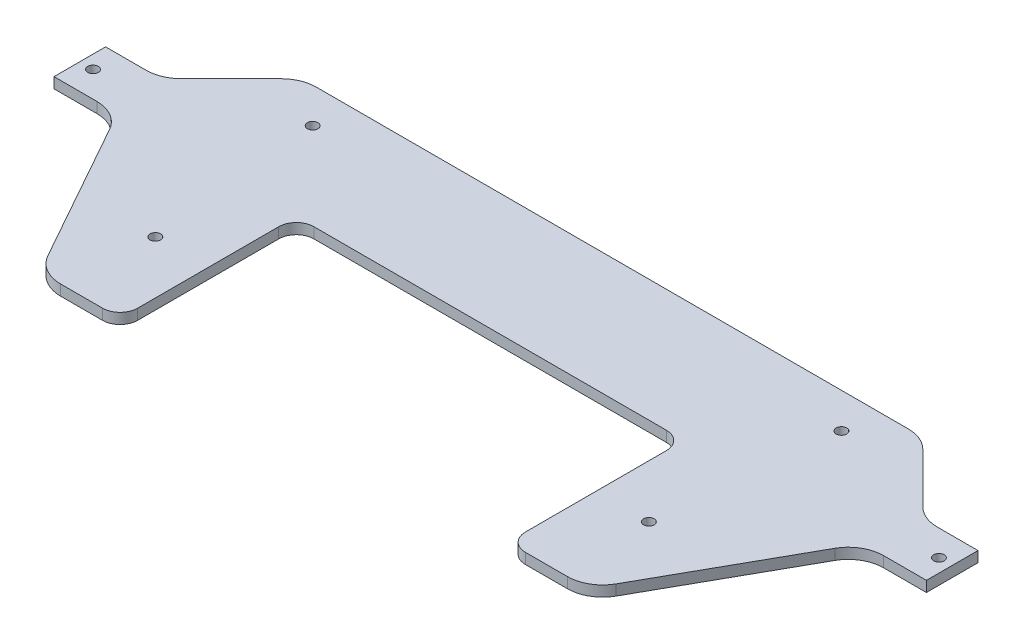
from build123d import *

# Parameters (mm, degrees)
SALIENTE_EXTRUIR1_DEPTH = 3
REDONDEO1_R             = 10
CROQUIS2_R              = 1.5
CORTAR_EXTRUIR1_DEPTH   = 135.610141171
CROQUIS4_W              = 110
CROQUIS4_H              = 50
CORTAR_EXTRUIR2_DEPTH   = 135.610141171
REDONDEO2_R             = 5
CROQUIS5_W              = 4
CROQUIS5_H              = 14.636342218
CORTAR_EXTRUIR3_DEPTH   = 135.610141171


with BuildPart() as part:
    # Croquis1 → Saliente-Extruir1 (new body)
    with BuildSketch(Plane(origin=(0, 0, 0), x_dir=(1, 0, 0), z_dir=(0, 1, 0))):
        Polygon((-88.1, 42.318171109), (88.1, 42.318171109), (108.1, 22.318171109), (127.75, 22.318171109), (127.75, 7.681828891), (105.75, 7.681828891), (77.75, -42.318171109), (-77.75, -42.318171109), (-105.75, 7.681828891), (-127.75, 7.681828891), (-127.75, 22.318171109), (-108.1, 22.318171109), align=None)
    extrude(amount=SALIENTE_EXTRUIR1_DEPTH)

    # Redondeo1
    redondeo1_edges = [part.edges().sort_by_distance(p)[0] for p in [
        (-88.1, 1.5, -42.318171109),
        (88.1, 1.5, -42.318171109),
        (108.1, 1.5, -22.318171109),
        (105.75, 1.5, -7.681828891),
        (77.75, 1.5, 42.318171109),
        (-77.75, 1.5, 42.318171109),
        (-105.75, 1.5, -7.681828891),
        (-108.1, 1.5, -22.318171109),
    ]]
    fillet(redondeo1_edges, radius=REDONDEO1_R)

    # Croquis2 → Cortar-Extruir1 (cut, through all)
    with BuildSketch(Plane(origin=(0, 3, 0), x_dir=(1, 0, 0), z_dir=(0, 1, 0))):
        with Locations(Location((70, -17.318171109, 0), (0, 0, 270))):
            Circle(CROQUIS2_R)
        with Locations(Location((-70, -17.318171109, 0), (0, 0, 270))):
            Circle(CROQUIS2_R)
        with Locations(Location((-119.996067812, 15, 0), (0, 0, 270))):
            Circle(CROQUIS2_R)
        with Locations(Location((119.996067812, 15, 0), (0, 0, 270))):
            Circle(CROQUIS2_R)
        with Locations(Location((-75, 32.318171109, 0), (0, 0, 270))):
            Circle(CROQUIS2_R)
        with Locations(Location((75, 32.318171109, 0), (0, 0, 270))):
            Circle(CROQUIS2_R)
        with Locations(Location((-17.5, -17.318171109, 0), (0, 0, 270))):
            Circle(CROQUIS2_R)
        with Locations(Location((17.5, -17.318171109, 0), (0, 0, 270))):
            Circle(CROQUIS2_R)
        with Locations(Location((-17.5, -37.318171109, 0), (0, 0, 270))):
            Circle(CROQUIS2_R)
        with Locations(Location((17.5, -37.318171109, 0), (0, 0, 270))):
            Circle(CROQUIS2_R)
    extrude(amount=-CORTAR_EXTRUIR1_DEPTH, mode=Mode.SUBTRACT)

    # Croquis4 → Cortar-Extruir2 (cut, through all)
    with BuildSketch(Plane(origin=(0, 3, 0), x_dir=(1, 0, 0), z_dir=(0, 1, 0))):
        with Locations((0, -17.318171109)):
            Rectangle(CROQUIS4_W, CROQUIS4_H)
    extrude(amount=-CORTAR_EXTRUIR2_DEPTH, mode=Mode.SUBTRACT)

    # Redondeo2
    redondeo2_edges = [part.edges().sort_by_distance(p)[0] for p in [
        (55, 1.5, 42.318171109),
        (-55, 1.5, 42.318171109),
        (-55, 1.5, -7.681828891),
        (55, 1.5, -7.681828891),
    ]]
    fillet(redondeo2_edges, radius=REDONDEO2_R)

    # Croquis5 → Cortar-Extruir3 (cut, through all)
    with BuildSketch(Plane(origin=(0, 3, 0), x_dir=(1, 0, 0), z_dir=(0, 1, 0))):
        with Locations((-125.75, 15)):
            Rectangle(CROQUIS5_W, CROQUIS5_H)
        with Locations((125.75, 15)):
            Rectangle(CROQUIS5_W, CROQUIS5_H)
    extrude(amount=-CORTAR_EXTRUIR3_DEPTH, mode=Mode.SUBTRACT)


solid = part.part
